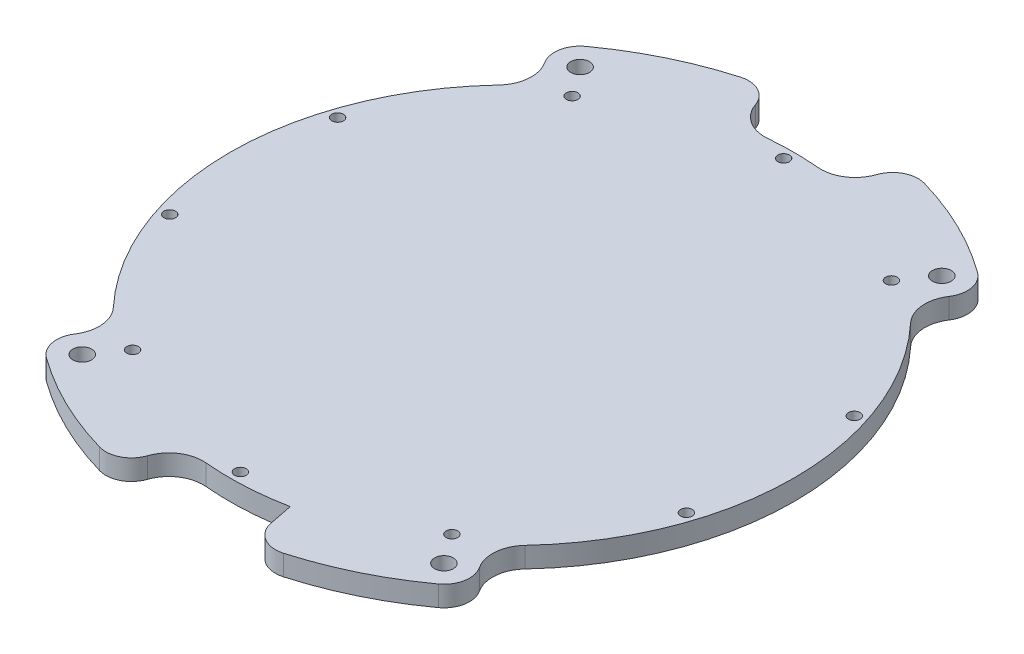
from build123d import *

# Parameters (mm, degrees)
SKETCH1_R            = 2.75
BOSS_EXTRUDE1_DEPTH  = 3
M3_CLEARANCE_HOLE1_D = 3.4
FILLET2_R            = 10


with BuildPart() as part:
    # Sketch1 → Boss-Extrude1 (new, symmetric)
    with BuildSketch(Plane(origin=(0, 0, 0), x_dir=(1, 0, 0), z_dir=(0, 1, 0))):
        with BuildLine():
            Line((-58.614111744, 67.959966353), (-53.914904373, 62.511483636))
            ThreePointArc((-53.914904373, 62.511483636), (-82.55, 0), (-53.914904373, -62.511483636))
            Line((-53.914904373, -62.511483636), (-58.614111744, -67.959966353))
            ThreePointArc((-58.614111744, -67.959966353), (-60.384815089, -73.721869234), (-57.34308106, -78.925980035))
            ThreePointArc((-57.34308106, -78.925980035), (-42.766558206, -87.684438581), (-26.890595122, -93.77864983))
            ThreePointArc((-26.890595122, -93.77864983), (-20.917021387, -92.971598421), (-17.46673379, -88.028883515))
            Line((-17.46673379, -88.028883515), (-16.066391761, -80.971436666))
            ThreePointArc((-16.066391761, -80.971436666), (0, -82.55), (16.066391761, -80.971436666))
            Line((16.066391761, -80.971436666), (17.46673379, -88.028883515))
            ThreePointArc((17.46673379, -88.028883515), (20.917021387, -92.971598421), (26.890595122, -93.77864983))
            ThreePointArc((26.890595122, -93.77864983), (42.766558206, -87.684438581), (57.34308106, -78.925980035))
            ThreePointArc((57.34308106, -78.925980035), (60.384815089, -73.721869234), (58.614111744, -67.959966353))
            Line((58.614111744, -67.959966353), (53.914904373, -62.511483636))
            ThreePointArc((53.914904373, -62.511483636), (82.55, 0), (53.914904373, 62.511483636))
            Line((53.914904373, 62.511483636), (58.614111744, 67.959966353))
            ThreePointArc((58.614111744, 67.959966353), (60.384815089, 73.721869234), (57.34308106, 78.925980035))
            ThreePointArc((57.34308106, 78.925980035), (42.766558206, 87.684438581), (26.890595122, 93.77864983))
            ThreePointArc((26.890595122, 93.77864983), (20.917021387, 92.971598421), (17.46673379, 88.028883515))
            Line((17.46673379, 88.028883515), (16.066391761, 80.971436666))
            ThreePointArc((16.066391761, 80.971436666), (0, 82.55), (-16.066391761, 80.971436666))
            Line((-16.066391761, 80.971436666), (-17.46673379, 88.028883515))
            ThreePointArc((-17.46673379, 88.028883515), (-20.917021387, 92.971598421), (-26.890595122, 93.77864983))
            ThreePointArc((-26.890595122, 93.77864983), (-42.766558206, 87.684438581), (-57.34308106, 78.925980035))
            ThreePointArc((-57.34308106, 78.925980035), (-60.384815089, 73.721869234), (-58.614111744, 67.959966353))
        make_face()
        with Locations(Location((52.934691668, -72.858352577, 0), (0, 0, 270))):
            Circle(SKETCH1_R, mode=Mode.SUBTRACT)
        with Locations(Location((52.934691668, 72.858352577, 0), (0, 0, 90))):
            Circle(SKETCH1_R, mode=Mode.SUBTRACT)
        with Locations(Location((-52.934691668, -72.858352577, 0), (0, 0, 90))):
            Circle(SKETCH1_R, mode=Mode.SUBTRACT)
        with Locations(Location((-52.934691668, 72.858352577, 0), (0, 0, 270))):
            Circle(SKETCH1_R, mode=Mode.SUBTRACT)
    extrude(amount=BOSS_EXTRUDE1_DEPTH, both=True)

    # M3 Clearance Hole1 (through all)
    with Locations(Plane(origin=(0, 3, 0), x_dir=(1, 0, 0), z_dir=(0, 1, 0))):
        with Locations((0, 79.5), (46.728927557, 64.316851053), (75.608993045, 24.566851053), (75.608993045, -24.566851053), (46.728927557, -64.316851053), (0, -79.5), (-46.728927557, -64.316851053), (-75.608993045, -24.566851053), (-75.608993045, 24.566851053), (-46.728927557, 64.316851053)):
            Hole(M3_CLEARANCE_HOLE1_D / 2)

    # Fillet2
    fillet2_edges = [part.edges().sort_by_distance(p)[0] for p in [
        (-53.914904373, 0, 62.511483636),
        (-53.914904373, 0, -62.511483636),
        (-16.066391761, 0, 80.971436666),
        (53.914904373, 0, 62.511483636),
        (53.914904373, 0, -62.511483636),
        (16.066391761, 0, -80.971436666),
        (-16.066391761, 0, -80.971436666),
    ]]
    fillet(fillet2_edges, radius=FILLET2_R)


solid = part.part
